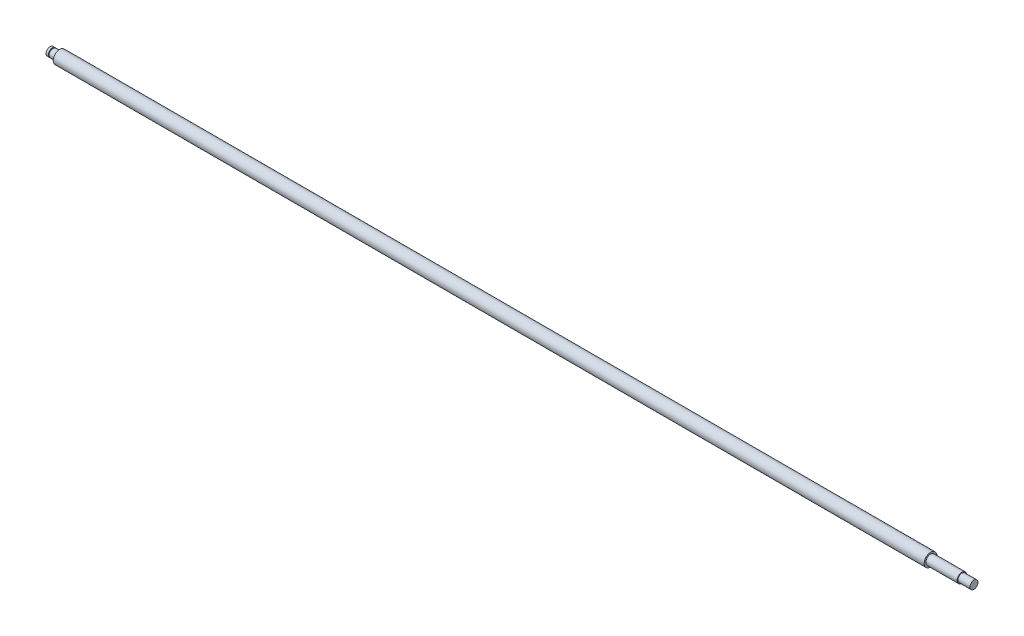
from build123d import *


with BuildPart() as part:
    # Esquisse1 → Révolution1 (revolve)
    with BuildSketch(Plane.XY, mode=Mode.PRIVATE) as r_volution1_sk:
        Polygon((-88.223286033, 0), (-88.223286033, 5), (-85.369889122, 5), (-85.369889122, 4), (-84.219889122, 4), (-84.219889122, 5), (-76.219889122, 5), (-76.219889122, 8), (1007.780110878, 8), (1007.780110878, 6), (1034.780110878, 6), (1046.780110878, 6), (1046.780110878, 5), (1061.780110878, 5), (1061.780110878, 0), align=None)
    revolve(r_volution1_sk.sketch.rotate(Axis((-89.400555638, 0, 0), (1, 0, 0)), 90), axis=Axis((-89.400555638, 0, 0), (1, 0, 0)))


solid = part.part
